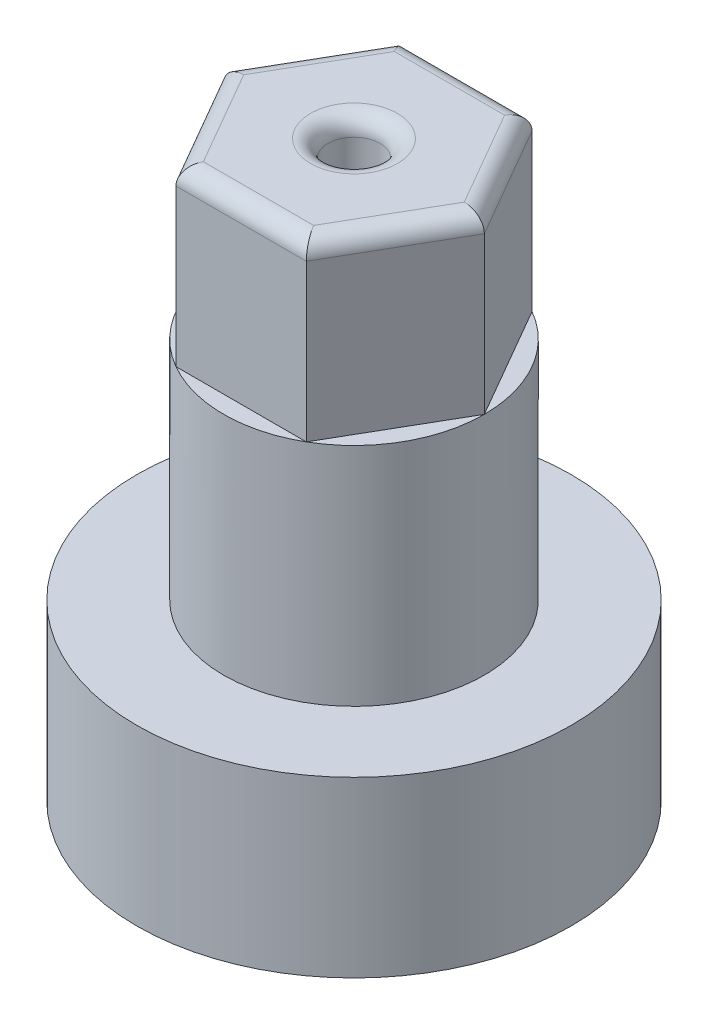
from build123d import *

# Parameters (mm, degrees)
CROQUIS1_R              = 12.5
CROQUIS1_R_2            = 0.75
SALIENTE_EXTRUIR1_DEPTH = 10
CROQUIS2_R              = 7.5
SALIENTE_EXTRUIR2_DEPTH = 13
SALIENTE_EXTRUIR4_START = -1
CROQUIS5_R              = 12.5
SALIENTE_EXTRUIR4_DEPTH = 1
SALIENTE_EXTRUIR3_DEPTH = 10
CROQUIS4_R              = 1.5
CORTAR_EXTRUIR1_DEPTH   = 38.436613095
REDONDEO1_R             = 1


with BuildPart() as part:
    # Croquis1 → Saliente-Extruir1 (new body)
    with BuildSketch(Plane(origin=(0, 0, 0), x_dir=(1, 0, 0), z_dir=(0, 1, 0))):
        with Locations(Location((0, 0, 0), (0, 0, 270))):
            Circle(CROQUIS1_R)
        with Locations(Location((7, 0, 0), (0, 0, 270))):
            Circle(CROQUIS1_R_2, mode=Mode.SUBTRACT)
        with Locations(Location((0, -7, 0), (0, 0, 270))):
            Circle(CROQUIS1_R_2, mode=Mode.SUBTRACT)
        with Locations(Location((-7, 0, 0), (0, 0, 270))):
            Circle(CROQUIS1_R_2, mode=Mode.SUBTRACT)
        with Locations(Location((0, 7, 0), (0, 0, 270))):
            Circle(CROQUIS1_R_2, mode=Mode.SUBTRACT)
    extrude(amount=SALIENTE_EXTRUIR1_DEPTH)

    # Croquis2 → Saliente-Extruir2 (add)
    with BuildSketch(Plane(origin=(0, 10, 0), x_dir=(1, 0, 0), z_dir=(0, 1, 0))):
        with Locations(Location((0, 0, 0), (0, 0, 94.421562439))):
            Circle(CROQUIS2_R)
    extrude(amount=SALIENTE_EXTRUIR2_DEPTH)

    # Croquis5 → Saliente-Extruir4 (add)
    with BuildSketch(Plane(origin=(0, 10, 0), x_dir=(1, 0, 0), z_dir=(0, 1, 0)).offset(SALIENTE_EXTRUIR4_START)):
        with Locations(Location((0, 0, 0), (0, 0, 270))):
            Circle(CROQUIS5_R)
    extrude(amount=SALIENTE_EXTRUIR4_DEPTH)

    # Croquis3 → Saliente-Extruir3 (add)
    with BuildSketch(Plane(origin=(0, 23, 0), x_dir=(1, 0, 0), z_dir=(0, 1, 0))):
        Polygon((7.5, 0), (3.75, 6.495190528), (-3.75, 6.495190528), (-7.5, 0), (-3.75, -6.495190528), (3.75, -6.495190528), align=None)
    extrude(amount=SALIENTE_EXTRUIR3_DEPTH)

    # Croquis4 → Cortar-Extruir1 (cut, through all)
    with BuildSketch(Plane(origin=(0, 33, 0), x_dir=(1, 0, 0), z_dir=(0, 1, 0))):
        with Locations(Location((0, 0, 0), (0, 0, 270))):
            Circle(CROQUIS4_R)
    extrude(amount=-CORTAR_EXTRUIR1_DEPTH, mode=Mode.SUBTRACT)

    # Redondeo1
    redondeo1_edges = [part.edges().sort_by_distance(p)[0] for p in [
        (5.625, 33, 3.247595264),
        (5.625, 33, -3.247595264),
        (0, 33, -6.495190528),
        (-5.625, 33, -3.247595264),
        (-5.625, 33, 3.247595264),
        (0, 33, 6.495190528),
        (0, 33, -1.5),
    ]]
    fillet(redondeo1_edges, radius=REDONDEO1_R)


solid = part.part
